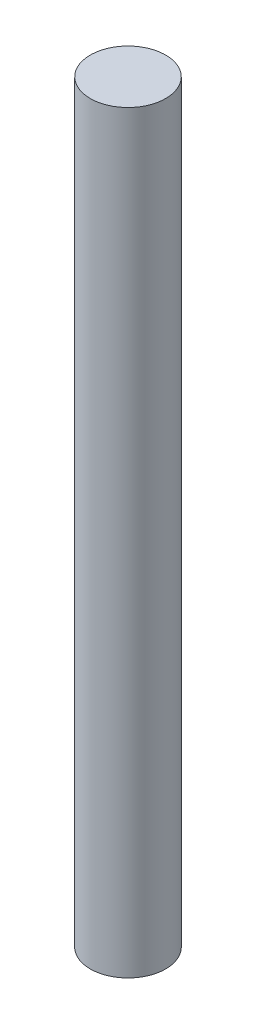
from build123d import *

# Parameters (mm, degrees)
SKETCH1_R           = 0.5
BOSS_EXTRUDE1_DEPTH = 5


with BuildPart() as part:
    # Sketch1 → Boss-Extrude1 (new, symmetric)
    with BuildSketch(Plane(origin=(0, 0, 0), x_dir=(1, 0, 0), z_dir=(0, 1, 0))):
        with Locations(Location((0, 0, 0), (0, 0, 270))):
            Circle(SKETCH1_R)
    extrude(amount=BOSS_EXTRUDE1_DEPTH, both=True)


solid = part.part
